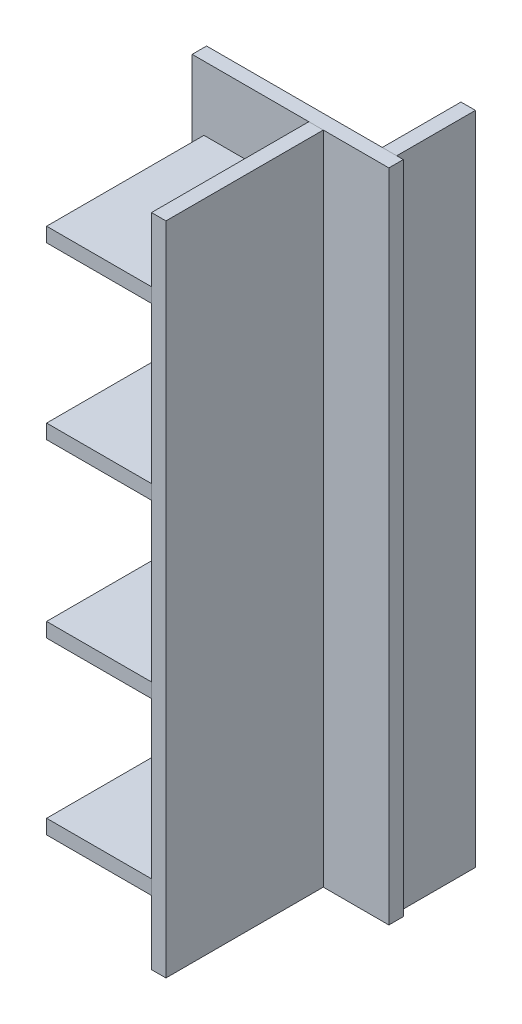
from build123d import *

# Parameters (mm, degrees)
SKIZZE1_W                         = 300
SKIZZE1_H                         = 1000
AUFSATZ_LINEAR_AUSTRAGEN1_DEPTH   = 22
SKIZZE2_W                         = 22
SKIZZE2_H                         = 1000
AUFSATZ_LINEAR_AUSTRAGEN2_DEPTH   = 240
SKIZZE3_W                         = 160
SKIZZE3_H                         = 22
AUFSATZ_LINEAR_AUSTRAGEN3_DEPTH   = 240
AUFSATZ_LINEAR_AUSTRAGEN3_2_DEPTH = 240
AUFSATZ_LINEAR_AUSTRAGEN3_3_DEPTH = 240
AUFSATZ_LINEAR_AUSTRAGEN3_4_DEPTH = 240
SKIZZE4_W                         = 22
SKIZZE4_H                         = 1000
AUFSATZ_LINEAR_AUSTRAGEN4_DEPTH   = 120


with BuildPart() as part:
    # Skizze1 → Aufsatz-Linear austragen1 (new body)
    with BuildSketch(Plane.XY):
        Rectangle(SKIZZE1_W, SKIZZE1_H)
    extrude(amount=AUFSATZ_LINEAR_AUSTRAGEN1_DEPTH)


with BuildPart() as body_2:
    # Skizze2 → Aufsatz-Linear austragen2 (new body)
    with BuildSketch(Plane.XY.offset(22)):
        with Locations((39, 0)):
            Rectangle(SKIZZE2_W, SKIZZE2_H)
    extrude(amount=AUFSATZ_LINEAR_AUSTRAGEN2_DEPTH)


with BuildPart() as body_3:
    # Skizze3 → Aufsatz-Linear austragen3 (new body)
    with BuildSketch(Plane.XY.offset(22)):
        with Locations((-52, -391)):
            Rectangle(SKIZZE3_W, SKIZZE3_H)
    extrude(amount=AUFSATZ_LINEAR_AUSTRAGEN3_DEPTH)


with BuildPart() as body_4:
    # Skizze3 → Aufsatz-Linear austragen3 2 (new body)
    with BuildSketch(Plane.XY.offset(22)):
        with Locations((-52, 391)):
            Rectangle(SKIZZE3_W, SKIZZE3_H)
    extrude(amount=AUFSATZ_LINEAR_AUSTRAGEN3_2_DEPTH)


with BuildPart() as body_5:
    # Skizze3 → Aufsatz-Linear austragen3 3 (new body)
    with BuildSketch(Plane.XY.offset(22)):
        with Locations((-52, -131)):
            Rectangle(SKIZZE3_W, SKIZZE3_H)
    extrude(amount=AUFSATZ_LINEAR_AUSTRAGEN3_3_DEPTH)


with BuildPart() as body_6:
    # Skizze3 → Aufsatz-Linear austragen3 4 (new body)
    with BuildSketch(Plane.XY.offset(22)):
        with Locations((-52, 131)):
            Rectangle(SKIZZE3_W, SKIZZE3_H)
    extrude(amount=AUFSATZ_LINEAR_AUSTRAGEN3_4_DEPTH)


with BuildPart() as body_7:
    # Skizze4 → Aufsatz-Linear austragen4 (new body)
    with BuildSketch(Plane(origin=(0, 0, 0), x_dir=(-1, 0, 0), z_dir=(0, 0, -1))):
        with Locations((-129, 0)):
            Rectangle(SKIZZE4_W, SKIZZE4_H)
    extrude(amount=AUFSATZ_LINEAR_AUSTRAGEN4_DEPTH)


solid = Compound([part.part, body_2.part, body_3.part, body_4.part, body_5.part, body_6.part, body_7.part])
